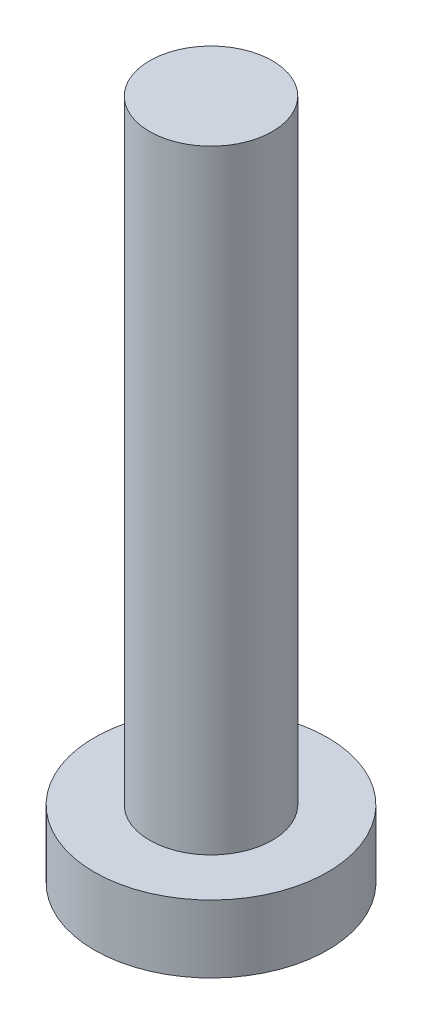
from build123d import *

# Parameters (mm, degrees)
SKETCH_1_R      = 3.8
EXTRUDE_1_DEPTH = 2.2
SKETCH_2_R      = 2
EXTRUDE_2_DEPTH = 20


with BuildPart() as part:
    # 草图1 → 凸台-拉伸1 (new body)
    with BuildSketch(Plane(origin=(0, 0, 0), x_dir=(1, 0, 0), z_dir=(0, 1, 0))):
        with Locations(Location((0, 0, 0), (0, 0, 270))):
            Circle(SKETCH_1_R)
    extrude(amount=EXTRUDE_1_DEPTH)

    # 草图2 → 凸台-拉伸2 (add)
    with BuildSketch(Plane(origin=(0, 2.2, 0), x_dir=(1, 0, 0), z_dir=(0, 1, 0))):
        with Locations(Location((0, 0, 0), (0, 0, 270))):
            Circle(SKETCH_2_R)
    extrude(amount=EXTRUDE_2_DEPTH)


solid = part.part
